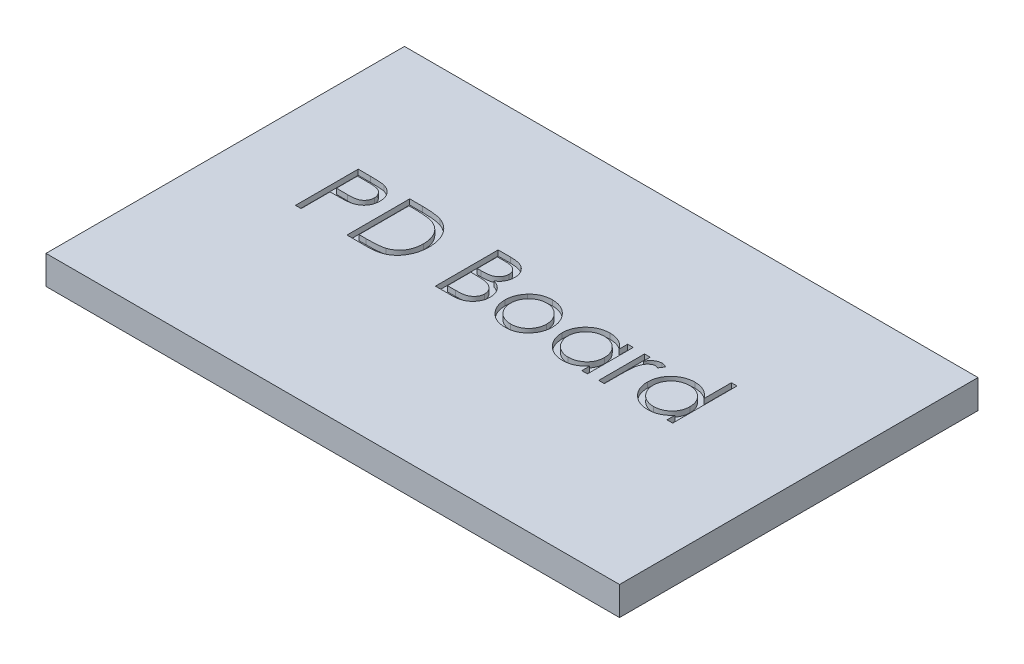
from build123d import *

# Parameters (mm, degrees)
SKETCH1_W           = 32
SKETCH1_H           = 20
BOSS_EXTRUDE1_DEPTH = 1.6
CUT_EXTRUDE1_DEPTH  = 0.3


with BuildPart() as part:
    # Sketch1 → Boss-Extrude1 (new body)
    with BuildSketch(Plane(origin=(0, 0, 0), x_dir=(1, 0, 0), z_dir=(0, 1, 0))):
        Rectangle(SKETCH1_W, SKETCH1_H)
    extrude(amount=BOSS_EXTRUDE1_DEPTH)

    # Sketch2 → Cut-Extrude1 (cut)
    # profile 1 of 7: a face of its own
    with BuildSketch(Plane(origin=(0, 1.6, 0), x_dir=(1, 0, 0), z_dir=(0, 1, 0))):
        with BuildLine():
            Line((-11.360048836, 2.780088179), (-10.673650599, 2.780088179))
            add(Edge.make_bspline(
                [(-10.673650599, 2.780088179), (-10.626439693, 2.780036283), (-10.5359815, 2.779936847), (-10.406266444, 2.776922101), (-10.288456713, 2.772895409), (-10.182806332, 2.767313516), (-10.088990234, 2.760716926), (-10.007432934, 2.751464886), (-9.937493378, 2.741804591), (-9.895586928, 2.731983184), (-9.876475118, 2.727504044)],
                knots=[0, 0, 0, 0, 1.415646017, 2.712440637, 3.8905458, 4.950247383, 5.884950622, 6.709939814, 7.411656543, 8, 8, 8, 8], degree=3))
            add(Edge.make_bspline(
                [(-9.876475118, 2.727504044), (-9.852281584, 2.720882094), (-9.804464607, 2.707794233), (-9.735563564, 2.681580509), (-9.670009719, 2.650498344), (-9.60757816, 2.615074404), (-9.549036077, 2.57378884), (-9.493510036, 2.528315222), (-9.441490056, 2.477603654), (-9.393268664, 2.422222914), (-9.348983866, 2.363102704), (-9.310854184, 2.299360474), (-9.278926957, 2.232069171), (-9.251543685, 2.1612756), (-9.231835231, 2.086385276), (-9.216988331, 2.007918564), (-9.207564703, 1.925883873), (-9.206662142, 1.869824006), (-9.206202682, 1.841286096)],
                knots=[0, 0, 0, 0, 0.999701418, 1.975846123, 2.934577507, 3.890451536, 4.834027766, 5.787354733, 6.749476667, 7.726910423, 8.712836071, 9.690891519, 10.682875813, 11.679750201, 12.712814741, 13.765529915, 14.8625177, 16, 16, 16, 16], degree=3))
            add(Edge.make_bspline(
                [(-9.206202682, 1.841286096), (-9.206624107, 1.812508319), (-9.207448653, 1.756202655), (-9.217344938, 1.673829867), (-9.23067513, 1.595111476), (-9.251172182, 1.520222026), (-9.278017855, 1.449606256), (-9.309509908, 1.382185024), (-9.347493439, 1.319105352), (-9.391138268, 1.260138234), (-9.439689863, 1.205228322), (-9.492942801, 1.154773527), (-9.550682093, 1.109069189), (-9.612724241, 1.068012845), (-9.67967409, 1.032556566), (-9.750516244, 1.000799261), (-9.82586646, 0.9741282), (-9.878008974, 0.960098139), (-9.90451999, 0.952964781)],
                knots=[0, 0, 0, 0, 1.121902311, 2.195077645, 3.232258892, 4.234102512, 5.217864754, 6.176164875, 7.132989551, 8.084763148, 9.034132444, 9.988522005, 10.94243251, 11.903244335, 12.886203696, 13.894208494, 14.929344452, 16, 16, 16, 16], degree=3))
            add(Edge.make_bspline(
                [(-9.90451999, 0.952964781), (-9.926447324, 0.9483018), (-9.974502351, 0.938082606), (-10.053645074, 0.926674149), (-10.145790459, 0.916936549), (-10.250812739, 0.909635411), (-10.368617644, 0.903385043), (-10.499268902, 0.898416949), (-10.643022979, 0.895687095), (-10.743294223, 0.895546302), (-10.795645791, 0.895472794)],
                knots=[0, 0, 0, 0, 0.601384939, 1.31797006, 2.144135048, 3.087295005, 4.142315834, 5.309527816, 6.595305764, 8, 8, 8, 8], degree=3))
            Line((-10.795645791, 0.895472794), (-11.045946272, 0.895472794))
            Line((-11.045946272, 0.895472794), (-11.045946272, -0.719911821))
            Line((-11.045946272, -0.719911821), (-11.360048836, -0.719911821))
            Line((-11.360048836, -0.719911821), (-11.360048836, 2.780088179))
        make_face()
        with BuildLine():
            Line((-11.045946272, 2.42111382), (-11.045946272, 1.254447153))
            Line((-11.045946272, 1.254447153), (-10.433165823, 1.246734813))
            add(Edge.make_bspline(
                [(-10.433165823, 1.246734813), (-10.403245898, 1.24671935), (-10.345486098, 1.246689498), (-10.262049874, 1.250674721), (-10.184640587, 1.255275254), (-10.113496012, 1.262011177), (-10.048584077, 1.271532435), (-9.989796548, 1.281144173), (-9.937589265, 1.295049535), (-9.876490064, 1.313772604), (-9.808406716, 1.34570522), (-9.734339168, 1.39205511), (-9.671568581, 1.451135818), (-9.617250285, 1.51756365), (-9.574144407, 1.591462779), (-9.542588414, 1.670531716), (-9.524047257, 1.753959565), (-9.521561063, 1.811047704), (-9.520305246, 1.839883852)],
                knots=[0, 0, 0, 0, 1.160613943, 2.240541288, 3.23993089, 4.169200891, 5.011653406, 5.7853311, 6.478053781, 7.106038997, 8.262395093, 9.384106736, 10.481365981, 11.59014053, 12.70357646, 13.786202915, 14.881775077, 16, 16, 16, 16], degree=3))
            add(Edge.make_bspline(
                [(-9.520305246, 1.839883852), (-9.521567893, 1.868022365), (-9.524077878, 1.923958248), (-9.542733741, 2.005937008), (-9.574083055, 2.084172713), (-9.617539649, 2.157145798), (-9.670280779, 2.223334602), (-9.731580123, 2.280831729), (-9.801293384, 2.327053432), (-9.866141615, 2.356886713), (-9.923742801, 2.375101989), (-9.973774761, 2.387846829), (-10.030265435, 2.398022435), (-10.093233215, 2.406261938), (-10.162190049, 2.413315399), (-10.237728364, 2.418101377), (-10.319562007, 2.420902833), (-10.376372578, 2.421041788), (-10.405822073, 2.42111382)],
                knots=[0, 0, 0, 0, 1.120700087, 2.227813068, 3.331159281, 4.466773991, 5.599788987, 6.693661531, 7.80175334, 8.91857717, 9.525282508, 10.207424825, 10.974604443, 11.810962634, 12.737642355, 13.736264703, 14.826523623, 16, 16, 16, 16], degree=3))
            Line((-10.405822073, 2.42111382), (-11.045946272, 2.42111382))
        make_face(mode=Mode.SUBTRACT)
    # profile 2 of 7: a face of its own
    with BuildSketch(Plane(origin=(0, 1.6, 0), x_dir=(1, 0, 0), z_dir=(0, 1, 0))):
        with BuildLine():
            Line((-8.488253964, -0.719911821), (-8.488253964, 2.780088179))
            Line((-8.488253964, 2.780088179), (-7.781523195, 2.780088179))
            add(Edge.make_bspline(
                [(-7.781523195, 2.780088179), (-7.720054207, 2.779645609), (-7.601296442, 2.778790566), (-7.429683994, 2.773369175), (-7.270900232, 2.763778709), (-7.125467373, 2.749809183), (-6.992986161, 2.732656149), (-6.873827553, 2.711155745), (-6.76737541, 2.685767574), (-6.701905969, 2.664122124), (-6.670946272, 2.653886256)],
                knots=[0, 0, 0, 0, 1.314313732, 2.53924729, 3.670748893, 4.714932338, 5.66265055, 6.526160246, 7.303039223, 8, 8, 8, 8], degree=3))
            add(Edge.make_bspline(
                [(-6.670946272, 2.653886256), (-6.630451533, 2.63845555), (-6.55038034, 2.607944056), (-6.436373218, 2.550387755), (-6.329047855, 2.485174653), (-6.22782871, 2.41221879), (-6.135027884, 2.329454442), (-6.047019987, 2.240397356), (-5.967405263, 2.141809016), (-5.894496967, 2.035734028), (-5.828761308, 1.923421976), (-5.77162215, 1.805086867), (-5.724168156, 1.681329659), (-5.68477493, 1.552494511), (-5.653728472, 1.418298133), (-5.632546541, 1.278584267), (-5.618575551, 1.133905078), (-5.617171499, 1.035730614), (-5.616459093, 0.985917506)],
                knots=[0, 0, 0, 0, 0.984719456, 1.947108742, 2.898477687, 3.838006223, 4.779231079, 5.722358779, 6.681677486, 7.655904652, 8.64651281, 9.637519902, 10.640069247, 11.656948941, 12.698408672, 13.768548281, 14.867775369, 16, 16, 16, 16], degree=3))
            add(Edge.make_bspline(
                [(-5.616459093, 0.985917506), (-5.61708806, 0.942656267), (-5.618327506, 0.857405478), (-5.629456822, 0.731764583), (-5.645633142, 0.609851011), (-5.67067734, 0.492245311), (-5.701079853, 0.377917093), (-5.740044005, 0.268084849), (-5.784679501, 0.16174104), (-5.836729379, 0.060323564), (-5.893870764, -0.035759808), (-5.955192508, -0.126335337), (-6.020629203, -0.210110558), (-6.090804836, -0.28733917), (-6.164812552, -0.357904749), (-6.243136883, -0.422396764), (-6.325979934, -0.479553319), (-6.412970656, -0.531620427), (-6.506646786, -0.577040783), (-6.608782652, -0.615470793), (-6.71981383, -0.647317408), (-6.839467787, -0.673888304), (-6.967951265, -0.694965606), (-7.10539023, -0.709091999), (-7.25157352, -0.718644931), (-7.351952785, -0.719481325), (-7.403618548, -0.719911821)],
                knots=[0, 0, 0, 0, 1.105936401, 2.179363191, 3.223086493, 4.248585256, 5.251745608, 6.245858792, 7.225916811, 8.198733463, 9.158002045, 10.082870192, 10.993790845, 11.873723703, 12.748670949, 13.606408763, 14.465103618, 15.319838547, 16.196477973, 17.123216899, 18.106603292, 19.147568657, 20.255746949, 21.433717677, 22.679120308, 24, 24, 24, 24], degree=3))
            Line((-7.403618548, -0.719911821), (-8.488253964, -0.719911821))
        make_face()
        with BuildLine():
            Line((-8.1741514, -0.360937462), (-7.772408612, -0.360937462))
            add(Edge.make_bspline(
                [(-7.772408612, -0.360937462), (-7.714680241, -0.360689366), (-7.603647443, -0.360212186), (-7.443989445, -0.356024982), (-7.298110049, -0.349183045), (-7.16598854, -0.339607967), (-7.047699515, -0.326939352), (-6.942995765, -0.312814449), (-6.852220507, -0.295216998), (-6.79729107, -0.279266039), (-6.771907811, -0.271894994)],
                knots=[0, 0, 0, 0, 1.375205317, 2.645023457, 3.804390687, 4.853969522, 5.800190428, 6.637939096, 7.370582563, 8, 8, 8, 8], degree=3))
            add(Edge.make_bspline(
                [(-6.771907811, -0.271894994), (-6.739959448, -0.260643436), (-6.67682581, -0.238409063), (-6.585944725, -0.197851402), (-6.50118772, -0.149809332), (-6.421077695, -0.096407058), (-6.34675104, -0.035761056), (-6.277326923, 0.030809933), (-6.212945122, 0.103644708), (-6.154270814, 0.18265287), (-6.10176251, 0.267342665), (-6.056291281, 0.356881499), (-6.016439749, 0.450288309), (-5.985161156, 0.548997468), (-5.960645572, 0.652126526), (-5.943280884, 0.75968274), (-5.93246616, 0.871646021), (-5.931204712, 0.947798146), (-5.930561657, 0.986618628)],
                knots=[0, 0, 0, 0, 0.998632004, 1.973411704, 2.929992603, 3.868527914, 4.809262121, 5.754881198, 6.702106254, 7.672490631, 8.653608572, 9.636854334, 10.631411391, 11.644891563, 12.686317036, 13.754757253, 14.855430412, 16, 16, 16, 16], degree=3))
            add(Edge.make_bspline(
                [(-5.930561657, 0.986618628), (-5.931074944, 1.027552108), (-5.932083302, 1.107966292), (-5.944757612, 1.225956988), (-5.963279168, 1.339437638), (-5.990062854, 1.448415833), (-6.024193732, 1.553104186), (-6.066788374, 1.652923696), (-6.115454993, 1.748928565), (-6.17335833, 1.83890293), (-6.236773924, 1.92399604), (-6.307151803, 2.001950955), (-6.383373842, 2.072945255), (-6.464608691, 2.138084568), (-6.55314579, 2.194748244), (-6.646899481, 2.245434925), (-6.747245152, 2.288450816), (-6.817057848, 2.311329679), (-6.852536817, 2.322956769)],
                knots=[0, 0, 0, 0, 1.122418816, 2.205001699, 3.251619955, 4.274784885, 5.280384055, 6.268708349, 7.249350384, 8.229342522, 9.199999885, 10.157847722, 11.105861043, 12.055065948, 13.010012805, 13.98527497, 14.976112212, 16, 16, 16, 16], degree=3))
            add(Edge.make_bspline(
                [(-6.852536817, 2.322956769), (-6.881887963, 2.331073196), (-6.944296554, 2.348330949), (-7.046136018, 2.367156322), (-7.160751167, 2.383760821), (-7.288650868, 2.39781886), (-7.429689327, 2.407906181), (-7.583975015, 2.415477496), (-7.75157462, 2.420584128), (-7.867757154, 2.420932836), (-7.92805765, 2.42111382)],
                knots=[0, 0, 0, 0, 0.674548936, 1.434276114, 2.292660221, 3.240891867, 4.284742987, 5.42552168, 6.663806718, 8, 8, 8, 8], degree=3))
            Line((-7.92805765, 2.42111382), (-8.1741514, 2.42111382))
            Line((-8.1741514, 2.42111382), (-8.1741514, -0.360937462))
        make_face(mode=Mode.SUBTRACT)
    # profile 3 of 7: a face of its own
    with BuildSketch(Plane(origin=(0, 1.6, 0), x_dir=(1, 0, 0), z_dir=(0, 1, 0))):
        with BuildLine():
            Line((-3.552356528, 2.780088179), (-2.8694639, 2.780088179))
            add(Edge.make_bspline(
                [(-2.8694639, 2.780088179), (-2.836035422, 2.779912428), (-2.771242712, 2.77957178), (-2.67702327, 2.774288649), (-2.588774459, 2.767084979), (-2.506470687, 2.755654887), (-2.430149985, 2.74186311), (-2.359582347, 2.725161294), (-2.294992175, 2.70513468), (-2.217879439, 2.673288399), (-2.129958778, 2.62596523), (-2.034760385, 2.556036665), (-1.953356146, 2.470504202), (-1.883169828, 2.374021547), (-1.827368709, 2.267885775), (-1.786999412, 2.154626586), (-1.761441536, 2.035704844), (-1.758813102, 1.954061666), (-1.757484734, 1.912800519)],
                knots=[0, 0, 0, 0, 1.001505555, 1.941167018, 2.826882275, 3.653841531, 4.429895133, 5.150066043, 5.825578002, 6.45369114, 7.647487171, 8.808567382, 9.977351308, 11.170798116, 12.373658725, 13.556498008, 14.765093433, 16, 16, 16, 16], degree=3))
            add(Edge.make_bspline(
                [(-1.757484734, 1.912800519), (-1.758577952, 1.874147963), (-1.760726229, 1.798192046), (-1.781268989, 1.687097937), (-1.813429657, 1.581346718), (-1.858134906, 1.481324332), (-1.916236903, 1.389290719), (-1.985095221, 1.304503453), (-2.068172024, 1.230552396), (-2.130415264, 1.189209494), (-2.162032009, 1.168209172)],
                knots=[0, 0, 0, 0, 1.044552857, 2.05264487, 3.044412934, 4.028983338, 5.005914585, 5.980388656, 6.974128949, 8, 8, 8, 8], degree=3))
            add(Edge.make_bspline(
                [(-2.162032009, 1.168209172), (-2.122271582, 1.152944174), (-2.046200034, 1.123738449), (-1.941514022, 1.072102985), (-1.851319177, 1.015940875), (-1.774922031, 0.954609025), (-1.709584376, 0.888500214), (-1.652531434, 0.8166451), (-1.60385006, 0.738106342), (-1.562137137, 0.653702806), (-1.529588381, 0.564296338), (-1.505212476, 0.470725562), (-1.491245027, 0.373326007), (-1.489257386, 0.307040627), (-1.488253964, 0.273577762)],
                knots=[0, 0, 0, 0, 1.27268992, 2.434971085, 3.483601985, 4.442670788, 5.356604649, 6.2567628, 7.179492994, 8.113709626, 9.066344395, 10.018646069, 10.999752585, 12, 12, 12, 12], degree=3))
            add(Edge.make_bspline(
                [(-1.488253964, 0.273577762), (-1.48923081, 0.23941089), (-1.491152782, 0.172186612), (-1.505332754, 0.073431477), (-1.529341861, -0.020943469), (-1.562413007, -0.111548652), (-1.605575322, -0.198208786), (-1.658103286, -0.28102205), (-1.72073485, -0.359156381), (-1.790797719, -0.433480004), (-1.870059864, -0.500307791), (-1.955575619, -0.559823498), (-2.048421939, -0.60876956), (-2.147073933, -0.649885582), (-2.252638249, -0.68129278), (-2.364640857, -0.703265354), (-2.482985159, -0.718070391), (-2.56419491, -0.719287596), (-2.605842105, -0.719911821)],
                knots=[0, 0, 0, 0, 0.978564426, 1.925352924, 2.850884081, 3.763762016, 4.682927383, 5.618979971, 6.567305752, 7.547517671, 8.540179244, 9.531824382, 10.526200242, 11.540722885, 12.589160233, 13.674978461, 14.80764778, 16, 16, 16, 16], degree=3))
            Line((-2.605842105, -0.719911821), (-3.552356528, -0.719911821))
            Line((-3.552356528, -0.719911821), (-3.552356528, 2.780088179))
        make_face()
        with BuildLine():
            Line((-3.238253964, 2.42111382), (-3.238253964, 1.299318948))
            Line((-3.238253964, 1.299318948), (-3.027216304, 1.299318948))
            add(Edge.make_bspline(
                [(-3.027216304, 1.299318948), (-2.996367509, 1.299718871), (-2.93676135, 1.300491604), (-2.850441453, 1.302705121), (-2.770316435, 1.308903164), (-2.696524602, 1.315099426), (-2.629182158, 1.325174014), (-2.568438296, 1.337166137), (-2.513339699, 1.349849042), (-2.449800154, 1.371418529), (-2.377727205, 1.403296204), (-2.300894101, 1.45276804), (-2.233159632, 1.511692393), (-2.175962444, 1.579683355), (-2.129150973, 1.654549541), (-2.096637258, 1.735096422), (-2.074589974, 1.819316554), (-2.072598443, 1.877134806), (-2.071587298, 1.906490422)],
                knots=[0, 0, 0, 0, 1.156816544, 2.235205308, 3.236616184, 4.169592532, 5.011045266, 5.787822928, 6.49130361, 7.128639758, 8.301311294, 9.436451833, 10.541879658, 11.654887649, 12.756523258, 13.837046038, 14.901820046, 16, 16, 16, 16], degree=3))
            add(Edge.make_bspline(
                [(-2.071587298, 1.906490422), (-2.072113478, 1.925916194), (-2.073145638, 1.964021966), (-2.08159894, 2.01957132), (-2.095966515, 2.071815073), (-2.114420808, 2.121469183), (-2.140209497, 2.166981033), (-2.17057296, 2.209924229), (-2.20725865, 2.248836347), (-2.249015963, 2.285205846), (-2.297024586, 2.317450374), (-2.351255878, 2.345691137), (-2.412443555, 2.368431913), (-2.47955641, 2.388348066), (-2.553627497, 2.40233636), (-2.633802051, 2.413989747), (-2.72073677, 2.419922489), (-2.780881872, 2.420707852), (-2.811971913, 2.42111382)],
                knots=[0, 0, 0, 0, 0.91205012, 1.789085906, 2.630437955, 3.453916878, 4.269457761, 5.079663411, 5.91843418, 6.774407191, 7.675494373, 8.627863946, 9.638891023, 10.736472738, 11.911756761, 13.175263542, 14.539845004, 16, 16, 16, 16], degree=3))
            Line((-2.811971913, 2.42111382), (-3.238253964, 2.42111382))
        make_face(mode=Mode.SUBTRACT)
        with BuildLine():
            Line((-3.238253964, 0.940344589), (-3.238253964, -0.360937462))
            Line((-3.238253964, -0.360937462), (-2.790938259, -0.360937462))
            add(Edge.make_bspline(
                [(-2.790938259, -0.360937462), (-2.758919333, -0.360553715), (-2.697207075, -0.359814092), (-2.608105845, -0.357399538), (-2.525522741, -0.351907262), (-2.449834605, -0.343261412), (-2.380224152, -0.333882963), (-2.317526449, -0.321271682), (-2.261233256, -0.306822722), (-2.195958948, -0.284488549), (-2.12245544, -0.249792079), (-2.043244584, -0.197477852), (-1.972818365, -0.135154544), (-1.913013106, -0.06302363), (-1.864000118, 0.015407697), (-1.828344663, 0.098553047), (-1.806353806, 0.185038574), (-1.803691637, 0.244005287), (-1.802356528, 0.273577762)],
                knots=[0, 0, 0, 0, 1.160039823, 2.235823828, 3.228722157, 4.157150951, 4.99529583, 5.772374946, 6.472645482, 7.099169577, 8.269452708, 9.405989375, 10.527446681, 11.663510218, 12.788923519, 13.866172445, 14.929861265, 16, 16, 16, 16], degree=3))
            add(Edge.make_bspline(
                [(-1.802356528, 0.273577762), (-1.802632633, 0.292071103), (-1.803180388, 0.328759485), (-1.811441003, 0.382675304), (-1.823454873, 0.434901177), (-1.838986307, 0.485578917), (-1.861605774, 0.533792294), (-1.888012319, 0.580494853), (-1.91897372, 0.625748333), (-1.967217886, 0.682960586), (-2.037389871, 0.748877599), (-2.137096646, 0.813415101), (-2.250468944, 0.865462909), (-2.332696437, 0.887562385), (-2.375173035, 0.898978403)],
                knots=[0, 0, 0, 0, 0.723448775, 1.435228256, 2.130040452, 2.821711965, 3.505591119, 4.210454504, 4.921174351, 5.648778258, 7.137944449, 8.670945889, 10.280296675, 12, 12, 12, 12], degree=3))
            add(Edge.make_bspline(
                [(-2.375173035, 0.898978403), (-2.392202131, 0.902433487), (-2.429124723, 0.909924822), (-2.489332304, 0.917832525), (-2.558068172, 0.924877585), (-2.63549105, 0.930088743), (-2.721698891, 0.935475286), (-2.816875809, 0.937570107), (-2.920633124, 0.940069368), (-2.992625497, 0.940250502), (-3.030020791, 0.940344589)],
                knots=[0, 0, 0, 0, 0.634451884, 1.375622551, 2.216452059, 3.157844607, 4.20941857, 5.370758133, 6.634282058, 8, 8, 8, 8], degree=3))
            Line((-3.030020791, 0.940344589), (-3.238253964, 0.940344589))
        make_face(mode=Mode.SUBTRACT)
    # profile 4 of 7: a face of its own
    with BuildSketch(Plane(origin=(0, 1.6, 0), x_dir=(1, 0, 0), z_dir=(0, 1, 0))):
        with BuildLine():
            add(Edge.make_bspline(
                [(0.375327766, 1.882652281), (0.423319039, 1.88163039), (0.517418197, 1.879626712), (0.655226083, 1.858211746), (0.786771219, 1.825464381), (0.912557411, 1.780192819), (1.030973706, 1.719510869), (1.14374495, 1.647101578), (1.250561959, 1.561318984), (1.314584988, 1.494960916), (1.347082574, 1.461278083)],
                knots=[0, 0, 0, 0, 1.054011418, 2.066658804, 3.057071809, 4.030435133, 4.997543892, 5.974964718, 6.972108034, 8, 8, 8, 8], degree=3))
            add(Edge.make_bspline(
                [(1.347082574, 1.461278083), (1.375064528, 1.429064097), (1.430486908, 1.365259555), (1.501552627, 1.261803942), (1.562774187, 1.154663841), (1.611837148, 1.042416514), (1.650522172, 0.926041843), (1.677987868, 0.805139832), (1.694324803, 0.679977485), (1.69652777, 0.594973647), (1.697643472, 0.551923115)],
                knots=[0, 0, 0, 0, 1.025258237, 2.030674902, 3.01204498, 3.988269485, 4.97094183, 5.956517959, 6.965070386, 8, 8, 8, 8], degree=3))
            add(Edge.make_bspline(
                [(1.697643472, 0.551923115), (1.696662134, 0.508623057), (1.694722966, 0.423060124), (1.676379349, 0.297040758), (1.647848264, 0.174845935), (1.607016425, 0.056987242), (1.554658316, -0.056895586), (1.490767629, -0.166305135), (1.414896011, -0.271457268), (1.328892015, -0.371459107), (1.233840139, -0.463625321), (1.13072399, -0.543953591), (1.021569957, -0.612775115), (0.904926603, -0.668211531), (0.781859116, -0.711921231), (0.652102048, -0.742621248), (0.515856978, -0.761182932), (0.422829757, -0.763566505), (0.375327766, -0.764783616)],
                knots=[0, 0, 0, 0, 0.998656419, 1.973391657, 2.932242238, 3.890759089, 4.846373663, 5.82037756, 6.809684879, 7.83454468, 8.860553229, 9.859544525, 10.845671541, 11.83227036, 12.833544569, 13.85385346, 14.904124723, 16, 16, 16, 16], degree=3))
            add(Edge.make_bspline(
                [(0.375327766, -0.764783616), (0.327593047, -0.76356242), (0.234102187, -0.761170645), (0.097376205, -0.742693363), (-0.032613414, -0.71193538), (-0.155842012, -0.668067887), (-0.272986859, -0.612773344), (-0.382773356, -0.544161654), (-0.485973272, -0.463601499), (-0.581045256, -0.371465562), (-0.667043861, -0.271455605), (-0.74291687, -0.166305567), (-0.806807196, -0.056895473), (-0.8591654, 0.056987212), (-0.899997213, 0.174845943), (-0.928528305, 0.297040756), (-0.94687192, 0.423060124), (-0.948811088, 0.508623057), (-0.949792426, 0.551923115)],
                knots=[0, 0, 0, 0, 1.099876186, 2.154163076, 3.173186993, 4.173200201, 5.163417411, 6.152872554, 7.150605724, 8.17532212, 9.198891216, 10.186952605, 11.159729845, 12.11414092, 13.071450619, 14.029093627, 15.002601286, 16, 16, 16, 16], degree=3))
            add(Edge.make_bspline(
                [(-0.949792426, 0.551923115), (-0.948669116, 0.594739661), (-0.946445154, 0.679509063), (-0.930124645, 0.804436124), (-0.902766089, 0.925133513), (-0.864034692, 1.041058989), (-0.814519501, 1.152814425), (-0.754158213, 1.260219256), (-0.682367581, 1.363207056), (-0.627165629, 1.426929136), (-0.599231528, 1.459174717)],
                knots=[0, 0, 0, 0, 1.031353054, 2.041901799, 3.029428768, 4.008703097, 4.981709435, 5.96992636, 6.972712378, 8, 8, 8, 8], degree=3))
            add(Edge.make_bspline(
                [(-0.599231528, 1.459174717), (-0.566782937, 1.493149657), (-0.502967074, 1.559967353), (-0.395618346, 1.645499877), (-0.283124525, 1.719415951), (-0.163399599, 1.778892166), (-0.037716741, 1.825730684), (0.094502502, 1.858296199), (0.232778017, 1.879549554), (0.327337638, 1.881607732), (0.375327766, 1.882652281)],
                knots=[0, 0, 0, 0, 1.027980169, 2.021703884, 2.998553061, 3.971491411, 4.943284454, 5.930300938, 6.949603206, 8, 8, 8, 8], degree=3))
        make_face()
        with BuildLine():
            add(Edge.make_bspline(
                [(0.373925523, 1.568549717), (0.339987911, 1.567585126), (0.272988783, 1.565680843), (0.174369198, 1.551196938), (0.079429044, 1.528249434), (-0.0120118, 1.495645378), (-0.099644972, 1.453546479), (-0.183554375, 1.401838119), (-0.263986815, 1.341205162), (-0.339368878, 1.271742491), (-0.40855119, 1.195863496), (-0.469029167, 1.115015137), (-0.520454273, 1.030508791), (-0.563294432, 0.94225658), (-0.59520162, 0.849364166), (-0.618374643, 0.752883535), (-0.632844883, 0.652618118), (-0.634731262, 0.5844571), (-0.635689862, 0.549819749)],
                knots=[0, 0, 0, 0, 1.021534396, 2.016698045, 2.994645724, 3.958388632, 4.93408049, 5.916473867, 6.921342795, 7.962252576, 8.998418191, 10.008913653, 10.997312074, 11.973003931, 12.956656626, 13.948281152, 14.957379055, 16, 16, 16, 16], degree=3))
            add(Edge.make_bspline(
                [(-0.635689862, 0.549819749), (-0.634083038, 0.505067722), (-0.630893794, 0.416243317), (-0.604958557, 0.285432194), (-0.561572277, 0.159850342), (-0.502984998, 0.040233956), (-0.429578779, -0.070438322), (-0.343091712, -0.169109806), (-0.244452012, -0.254295618), (-0.134835512, -0.324976463), (-0.016481194, -0.381136219), (0.108775127, -0.420935195), (0.239415821, -0.446806887), (0.328696552, -0.449378362), (0.373925523, -0.450681052)],
                knots=[0, 0, 0, 0, 1.016792936, 2.018143844, 3.017858371, 4.030088057, 5.03801393, 6.028138512, 7.003788237, 7.991172063, 8.984598303, 9.972568034, 10.972917682, 12, 12, 12, 12], degree=3))
            add(Edge.make_bspline(
                [(0.373925523, -0.450681052), (0.419151892, -0.449370772), (0.508427488, -0.446784315), (0.638886665, -0.421065495), (0.763800636, -0.380961834), (0.882032024, -0.325039624), (0.991598627, -0.25402721), (1.090947749, -0.169590833), (1.17669636, -0.070176981), (1.250029965, 0.040380548), (1.309576707, 0.1596649), (1.352759909, 0.285455372), (1.378757495, 0.416237414), (1.381938324, 0.505065745), (1.383540907, 0.549819749)],
                knots=[0, 0, 0, 0, 1.02726834, 2.027799167, 3.010890988, 4.004497153, 4.992059811, 5.971914811, 6.958719428, 7.966827853, 8.981595046, 9.981490638, 10.983022906, 12, 12, 12, 12], degree=3))
            add(Edge.make_bspline(
                [(1.383540907, 0.549819749), (1.382582637, 0.584457307), (1.380696908, 0.652618733), (1.366221944, 0.752881186), (1.343066404, 0.849372783), (1.311094787, 0.942224786), (1.268440773, 1.030737291), (1.21602398, 1.114767018), (1.155792955, 1.196143564), (1.085775834, 1.271497204), (1.010472456, 1.341232241), (0.930007418, 1.40186163), (0.846222439, 1.453319226), (0.758843856, 1.496005467), (0.667391289, 1.527952807), (0.57258416, 1.551329438), (0.47438535, 1.565619635), (0.407626306, 1.567566776), (0.373925523, 1.568549717)],
                knots=[0, 0, 0, 0, 1.042956736, 2.052379634, 3.044323526, 4.02829302, 5.004299113, 5.996692471, 7.007513377, 8.048758398, 9.090003419, 10.095195979, 11.07790575, 12.047570684, 13.018257071, 13.989683339, 14.985167495, 16, 16, 16, 16], degree=3))
        make_face(mode=Mode.SUBTRACT)
    # profile 5 of 7: a face of its own
    with BuildSketch(Plane(origin=(0, 1.6, 0), x_dir=(1, 0, 0), z_dir=(0, 1, 0))):
        with BuildLine():
            Line((4.928412702, 1.837780487), (4.928412702, -0.719911821))
            Line((4.928412702, -0.719911821), (4.614310138, -0.719911821))
            Line((4.614310138, -0.719911821), (4.614310138, -0.277503969))
            add(Edge.make_bspline(
                [(4.614310138, -0.277503969), (4.578891348, -0.317543563), (4.509771132, -0.395681334), (4.394330014, -0.497763506), (4.271961836, -0.582141828), (4.143260515, -0.650291743), (4.008342272, -0.7014838), (3.867506185, -0.737869959), (3.720694804, -0.761263794), (3.620442449, -0.763599816), (3.569638664, -0.764783616)],
                knots=[0, 0, 0, 0, 1.074387032, 2.096679803, 3.090159297, 4.057316773, 5.018401886, 5.985159533, 6.978961417, 8, 8, 8, 8], degree=3))
            add(Edge.make_bspline(
                [(3.569638664, -0.764783616), (3.52447071, -0.763557244), (3.435397505, -0.761138783), (3.304368428, -0.74237648), (3.178276178, -0.712245858), (3.057001606, -0.670344969), (2.94132946, -0.614764147), (2.830269364, -0.548222899), (2.724396672, -0.468982069), (2.625325133, -0.37839404), (2.534093132, -0.279999053), (2.45403186, -0.175053506), (2.38727878, -0.064011202), (2.331458699, 0.051721951), (2.288462355, 0.173036871), (2.25848872, 0.299514039), (2.239748274, 0.431003912), (2.237330813, 0.520543436), (2.23610501, 0.565945551)],
                knots=[0, 0, 0, 0, 1.033919861, 2.038935746, 3.024066025, 3.998881131, 4.97069526, 5.957263378, 6.95902576, 7.993208707, 9.027059324, 10.027763471, 11.009749337, 11.988697705, 12.965288445, 13.950418724, 14.960734635, 16, 16, 16, 16], degree=3))
            add(Edge.make_bspline(
                [(2.23610501, 0.565945551), (2.237357981, 0.610409254), (2.239835038, 0.698311598), (2.258288258, 0.827590296), (2.289319267, 0.952108556), (2.332867114, 1.0714655), (2.388709069, 1.18580555), (2.456637156, 1.295209575), (2.536656281, 1.399978972), (2.628908688, 1.497650199), (2.728843458, 1.587870813), (2.835752189, 1.666279859), (2.94697547, 1.733996707), (3.064238481, 1.787650184), (3.185805586, 1.831059288), (3.312759032, 1.861092256), (3.44457061, 1.878789578), (3.534061102, 1.881352342), (3.579454369, 1.882652281)],
                knots=[0, 0, 0, 0, 1.020392517, 2.01726096, 2.990465484, 3.961182959, 4.928053699, 5.906110375, 6.912531644, 7.948652711, 8.985773172, 9.998621852, 10.987621588, 11.969261332, 12.953316658, 13.946091881, 14.958173133, 16, 16, 16, 16], degree=3))
            add(Edge.make_bspline(
                [(3.579454369, 1.882652281), (3.631654228, 1.88121453), (3.734015688, 1.878395167), (3.883743697, 1.85493244), (4.025388175, 1.815293973), (4.160042527, 1.761376474), (4.287223213, 1.689727745), (4.405726198, 1.599347784), (4.516791681, 1.490806597), (4.581171973, 1.407436153), (4.614310138, 1.364523275)],
                knots=[0, 0, 0, 0, 1.038897134, 2.037228247, 3.008116434, 3.962042015, 4.918381754, 5.904844433, 6.921570401, 8, 8, 8, 8], degree=3))
            Line((4.614310138, 1.364523275), (4.614310138, 1.837780487))
            Line((4.614310138, 1.837780487), (4.928412702, 1.837780487))
        make_face()
        with BuildLine():
            add(Edge.make_bspline(
                [(3.5836611, 1.568549717), (3.537746762, 1.56691608), (3.447119162, 1.563691539), (3.31407516, 1.538518043), (3.186761746, 1.496633449), (3.065815671, 1.439351548), (2.953147455, 1.367322811), (2.852453784, 1.280201428), (2.762911083, 1.180364414), (2.687602818, 1.068262303), (2.626212321, 0.948084212), (2.58304529, 0.822459774), (2.554576042, 0.693654797), (2.551667522, 0.606292111), (2.550207574, 0.562439942)],
                knots=[0, 0, 0, 0, 1.031046209, 2.035121221, 3.029706178, 4.034933723, 5.034054252, 6.02443088, 7.017295772, 8.038157696, 9.050218397, 10.03989886, 11.016116709, 12, 12, 12, 12], degree=3))
            add(Edge.make_bspline(
                [(2.550207574, 0.562439942), (2.552072467, 0.518849835), (2.555794944, 0.431840479), (2.582545639, 0.302859902), (2.627425512, 0.17720586), (2.688667575, 0.055944866), (2.7653542, -0.056639234), (2.854242852, -0.158379357), (2.956193133, -0.245868945), (3.06912064, -0.319106519), (3.189728611, -0.378269039), (3.316562542, -0.419434679), (3.44723818, -0.44601246), (3.536090514, -0.449116936), (3.580856613, -0.450681052)],
                knots=[0, 0, 0, 0, 0.979072187, 1.954306742, 2.945804271, 3.96968567, 4.997920485, 5.998718438, 6.996577872, 8.005894225, 9.015743152, 10.005417472, 10.995077863, 12, 12, 12, 12], degree=3))
            add(Edge.make_bspline(
                [(3.580856613, -0.450681052), (3.626303115, -0.449021088), (3.716691702, -0.445719584), (3.85013041, -0.420438319), (3.979625372, -0.378669521), (4.103412601, -0.320770394), (4.218728732, -0.249013038), (4.32222661, -0.165005947), (4.409742578, -0.067302763), (4.483935188, 0.04007369), (4.542110604, 0.157785687), (4.584486663, 0.283119877), (4.609540569, 0.416080625), (4.612698299, 0.506944552), (4.614310138, 0.553325358)],
                knots=[0, 0, 0, 0, 1.01762866, 2.023962475, 3.030623092, 4.058876274, 5.077231937, 6.066672613, 7.034107872, 8.005628644, 8.981990164, 9.965428785, 10.961468474, 12, 12, 12, 12], degree=3))
            add(Edge.make_bspline(
                [(4.614310138, 0.553325358), (4.613350482, 0.588663189), (4.611461574, 0.658219222), (4.597031005, 0.76034674), (4.574076078, 0.858080466), (4.541729908, 0.951523155), (4.499238624, 1.04015817), (4.447990858, 1.12462193), (4.387085408, 1.204475142), (4.317502712, 1.278618213), (4.24133751, 1.346244675), (4.160742969, 1.406608916), (4.074764222, 1.456197689), (3.984847185, 1.49723896), (3.890835851, 1.52989811), (3.791965231, 1.551685804), (3.689286244, 1.566646125), (3.619240189, 1.567908506), (3.5836611, 1.568549717)],
                knots=[0, 0, 0, 0, 1.050140795, 2.067009409, 3.05949893, 4.030605086, 5.00011959, 5.97591094, 6.962425594, 7.979863591, 8.993523472, 9.986985069, 10.967611495, 11.937549037, 12.921786183, 13.919465291, 14.943216303, 16, 16, 16, 16], degree=3))
        make_face(mode=Mode.SUBTRACT)
    # profile 6 of 7: a face of its own
    with BuildSketch(Plane(origin=(0, 1.6, 0), x_dir=(1, 0, 0), z_dir=(0, 1, 0))):
        with BuildLine():
            Line((5.55661783, 1.837780487), (5.870720395, 1.837780487))
            Line((5.870720395, 1.837780487), (5.870720395, 1.461278083))
            add(Edge.make_bspline(
                [(5.870720395, 1.461278083), (5.893909153, 1.496333911), (5.938257474, 1.56337791), (6.011970404, 1.652047211), (6.087473735, 1.725462258), (6.165128922, 1.783965777), (6.245507022, 1.827778896), (6.326843974, 1.859871931), (6.410419444, 1.878849246), (6.466581368, 1.881382905), (6.494718792, 1.882652281)],
                knots=[0, 0, 0, 0, 1.2804753, 2.448899062, 3.506932113, 4.484331642, 5.4025378, 6.288909075, 7.142734305, 8, 8, 8, 8], degree=3))
            add(Edge.make_bspline(
                [(6.494718792, 1.882652281), (6.516545119, 1.881461755), (6.561454204, 1.879012169), (6.629436794, 1.861801344), (6.699480245, 1.834323322), (6.744622633, 1.808483099), (6.768156292, 1.795012057)],
                knots=[0, 0, 0, 0, 0.901110191, 1.854092781, 2.881294221, 4, 4, 4, 4], degree=3))
            Line((6.768156292, 1.795012057), (6.59568033, 1.522976801))
            add(Edge.make_bspline(
                [(6.59568033, 1.522976801), (6.580571309, 1.529717067), (6.551891495, 1.542511382), (6.509936929, 1.557653392), (6.471255592, 1.566569308), (6.446612033, 1.567920026), (6.435123439, 1.568549717)],
                knots=[0, 0, 0, 0, 1.180555205, 2.24091978, 3.179933427, 4, 4, 4, 4], degree=3))
            add(Edge.make_bspline(
                [(6.435123439, 1.568549717), (6.409917706, 1.56686968), (6.358505316, 1.563442891), (6.283020817, 1.536504083), (6.209773611, 1.492978843), (6.151601949, 1.444707731), (6.106559696, 1.398159934), (6.07441947, 1.357511531), (6.044936723, 1.311932899), (6.016766503, 1.262203216), (5.991100209, 1.20747337), (5.96714554, 1.148290156), (5.945486677, 1.084585027), (5.933136432, 1.040202507), (5.926810138, 1.017467987)],
                knots=[0, 0, 0, 0, 1.125678352, 2.296057538, 3.5422874, 4.923748041, 5.663163013, 6.437101912, 7.23742474, 8.08941207, 8.991984279, 9.93940061, 10.944477711, 12, 12, 12, 12], degree=3))
            add(Edge.make_bspline(
                [(5.926810138, 1.017467987), (5.922077745, 0.997190813), (5.911595853, 0.952278414), (5.901404315, 0.87692989), (5.891334797, 0.787906231), (5.884238179, 0.684959638), (5.877660137, 0.568347194), (5.873950055, 0.437891248), (5.870846914, 0.293457897), (5.870763847, 0.192483544), (5.870720395, 0.139663499)],
                knots=[0, 0, 0, 0, 0.566838948, 1.255505196, 2.06880316, 3.007127437, 4.065329342, 5.249902469, 6.561414163, 8, 8, 8, 8], degree=3))
            Line((5.870720395, 0.139663499), (5.870720395, -0.719911821))
            Line((5.870720395, -0.719911821), (5.55661783, -0.719911821))
            Line((5.55661783, -0.719911821), (5.55661783, 1.837780487))
        make_face()
    # profile 7 of 7: a face of its own
    with BuildSketch(Plane(origin=(0, 1.6, 0), x_dir=(1, 0, 0), z_dir=(0, 1, 0))):
        with BuildLine():
            Line((9.684822959, 2.869831769), (9.684822959, -0.719911821))
            Line((9.684822959, -0.719911821), (9.370720395, -0.719911821))
            Line((9.370720395, -0.719911821), (9.370720395, -0.277503969))
            add(Edge.make_bspline(
                [(9.370720395, -0.277503969), (9.335301604, -0.317543563), (9.266181389, -0.395681334), (9.150740271, -0.497763506), (9.028372093, -0.582141828), (8.899670772, -0.650291743), (8.764752528, -0.7014838), (8.623916441, -0.737869959), (8.47710506, -0.761263794), (8.376852705, -0.763599816), (8.32604892, -0.764783616)],
                knots=[0, 0, 0, 0, 1.074387032, 2.096679803, 3.090159297, 4.057316773, 5.018401886, 5.985159533, 6.978961417, 8, 8, 8, 8], degree=3))
            add(Edge.make_bspline(
                [(8.32604892, -0.764783616), (8.280880966, -0.763557244), (8.191807761, -0.761138783), (8.060778684, -0.74237648), (7.934686435, -0.712245858), (7.813411862, -0.670344969), (7.697739717, -0.614764147), (7.58667962, -0.548222899), (7.480806928, -0.468982069), (7.381735389, -0.37839404), (7.290503389, -0.279999053), (7.210442116, -0.175053506), (7.143689036, -0.064011202), (7.087868956, 0.051721951), (7.044872611, 0.173036871), (7.014898977, 0.299514039), (6.99615853, 0.431003912), (6.99374107, 0.520543436), (6.992515266, 0.565945551)],
                knots=[0, 0, 0, 0, 1.033919861, 2.038935746, 3.024066025, 3.998881131, 4.97069526, 5.957263378, 6.95902576, 7.993208707, 9.027059324, 10.027763471, 11.009749337, 11.988697705, 12.965288445, 13.950418724, 14.960734635, 16, 16, 16, 16], degree=3))
            add(Edge.make_bspline(
                [(6.992515266, 0.565945551), (6.993768238, 0.610409254), (6.996245295, 0.698311598), (7.014698514, 0.827590296), (7.045729523, 0.952108556), (7.089277371, 1.0714655), (7.145119326, 1.18580555), (7.213047413, 1.295209575), (7.293066537, 1.399978972), (7.385318944, 1.497650199), (7.485253715, 1.587870813), (7.592162446, 1.666279859), (7.703385727, 1.733996707), (7.820648737, 1.787650184), (7.942215842, 1.831059288), (8.069169288, 1.861092256), (8.200980867, 1.878789578), (8.290471359, 1.881352342), (8.335864625, 1.882652281)],
                knots=[0, 0, 0, 0, 1.020392517, 2.01726096, 2.990465484, 3.961182959, 4.928053699, 5.906110375, 6.912531644, 7.948652711, 8.985773172, 9.998621852, 10.987621588, 11.969261332, 12.953316658, 13.946091881, 14.958173133, 16, 16, 16, 16], degree=3))
            add(Edge.make_bspline(
                [(8.335864625, 1.882652281), (8.388081433, 1.881085185), (8.490577224, 1.87800915), (8.640475745, 1.852302783), (8.782263356, 1.809139905), (8.916756343, 1.750048624), (9.043152903, 1.673247873), (9.162379544, 1.580496425), (9.272362867, 1.469169279), (9.33743469, 1.385557705), (9.370720395, 1.342788499)],
                knots=[0, 0, 0, 0, 1.031072012, 2.023879775, 2.993683497, 3.952812103, 4.918022106, 5.908088563, 6.929940113, 8, 8, 8, 8], degree=3))
            Line((9.370720395, 1.342788499), (9.370720395, 2.869831769))
            Line((9.370720395, 2.869831769), (9.684822959, 2.869831769))
        make_face()
        with BuildLine():
            add(Edge.make_bspline(
                [(8.340071356, 1.568549717), (8.294157018, 1.56691608), (8.203529418, 1.563691539), (8.070485416, 1.538518043), (7.943172002, 1.496633449), (7.822225928, 1.439351548), (7.709557711, 1.367322811), (7.60886404, 1.280201428), (7.519321339, 1.180364414), (7.444013075, 1.068262303), (7.382622578, 0.948084212), (7.339455546, 0.822459774), (7.310986299, 0.693654797), (7.308077778, 0.606292111), (7.30661783, 0.562439942)],
                knots=[0, 0, 0, 0, 1.031046209, 2.035121221, 3.029706178, 4.034933723, 5.034054252, 6.02443088, 7.017295772, 8.038157696, 9.050218397, 10.03989886, 11.016116709, 12, 12, 12, 12], degree=3))
            add(Edge.make_bspline(
                [(7.30661783, 0.562439942), (7.308482724, 0.518849835), (7.312205201, 0.431840479), (7.338955895, 0.302859902), (7.383835768, 0.17720586), (7.445077831, 0.055944866), (7.521764456, -0.056639234), (7.610653108, -0.158379357), (7.71260339, -0.245868945), (7.825530897, -0.319106519), (7.946138867, -0.378269039), (8.072972799, -0.419434679), (8.203648437, -0.44601246), (8.292500771, -0.449116936), (8.337266869, -0.450681052)],
                knots=[0, 0, 0, 0, 0.979072187, 1.954306742, 2.945804271, 3.96968567, 4.997920485, 5.998718438, 6.996577872, 8.005894225, 9.015743152, 10.005417472, 10.995077863, 12, 12, 12, 12], degree=3))
            add(Edge.make_bspline(
                [(8.337266869, -0.450681052), (8.382713372, -0.449021088), (8.473101958, -0.445719584), (8.606540666, -0.420438319), (8.736035629, -0.378669521), (8.859822857, -0.320770394), (8.975138988, -0.249013038), (9.078636866, -0.165005947), (9.166152834, -0.067302763), (9.240345444, 0.04007369), (9.298520861, 0.157785687), (9.34089692, 0.283119877), (9.365950826, 0.416080625), (9.369108555, 0.506944552), (9.370720395, 0.553325358)],
                knots=[0, 0, 0, 0, 1.01762866, 2.023962475, 3.030623092, 4.058876274, 5.077231937, 6.066672613, 7.034107872, 8.005628644, 8.981990164, 9.965428785, 10.961468474, 12, 12, 12, 12], degree=3))
            add(Edge.make_bspline(
                [(9.370720395, 0.553325358), (9.369760738, 0.588663189), (9.367871831, 0.658219222), (9.353441261, 0.76034674), (9.330486335, 0.858080466), (9.298140165, 0.951523155), (9.25564888, 1.04015817), (9.204401115, 1.12462193), (9.143495665, 1.204475142), (9.073912969, 1.278618213), (8.997747766, 1.346244675), (8.917153226, 1.406608916), (8.831174479, 1.456197689), (8.741257442, 1.49723896), (8.647246107, 1.52989811), (8.548375487, 1.551685804), (8.4456965, 1.566646125), (8.375650445, 1.567908506), (8.340071356, 1.568549717)],
                knots=[0, 0, 0, 0, 1.050140795, 2.067009409, 3.05949893, 4.030605086, 5.00011959, 5.97591094, 6.962425594, 7.979863591, 8.993523472, 9.986985069, 10.967611495, 11.937549037, 12.921786183, 13.919465291, 14.943216303, 16, 16, 16, 16], degree=3))
        make_face(mode=Mode.SUBTRACT)
    extrude(amount=-CUT_EXTRUDE1_DEPTH, mode=Mode.SUBTRACT)


solid = part.part
